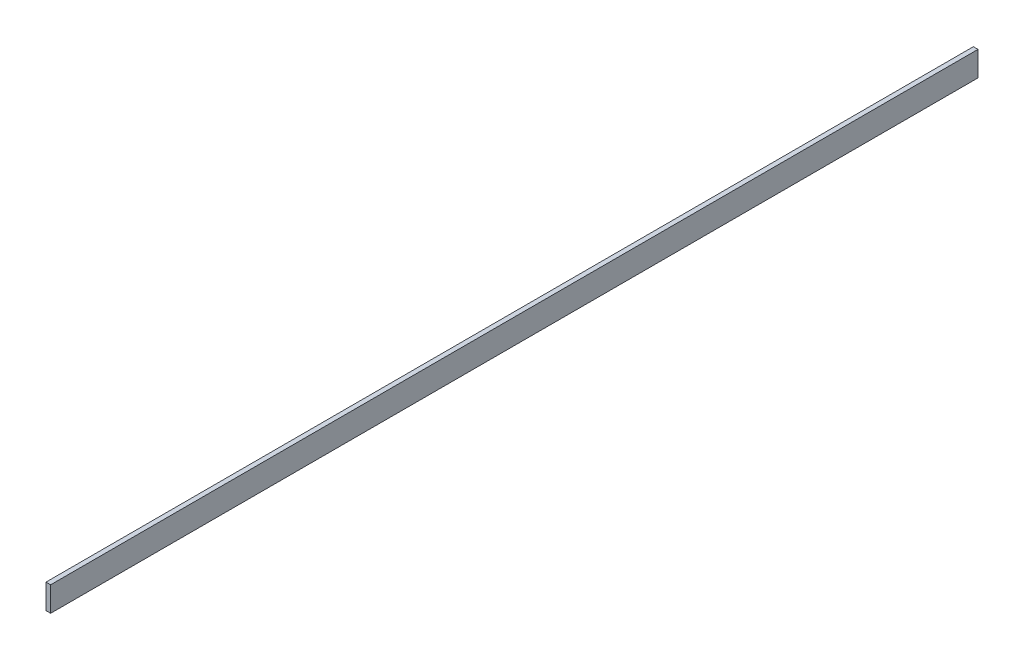
from build123d import *

# Parameters (mm, degrees)
SKETCH_1_W      = 3
SKETCH_1_H      = 16
EXTRUDE_1_DEPTH = 600


with BuildPart() as part:
    # Эскиз1 → Бобышка-Вытянуть1 (new body)
    with BuildSketch(Plane.XY):
        with Locations((1.5, 8)):
            Rectangle(SKETCH_1_W, SKETCH_1_H)
    extrude(amount=EXTRUDE_1_DEPTH)


solid = part.part
